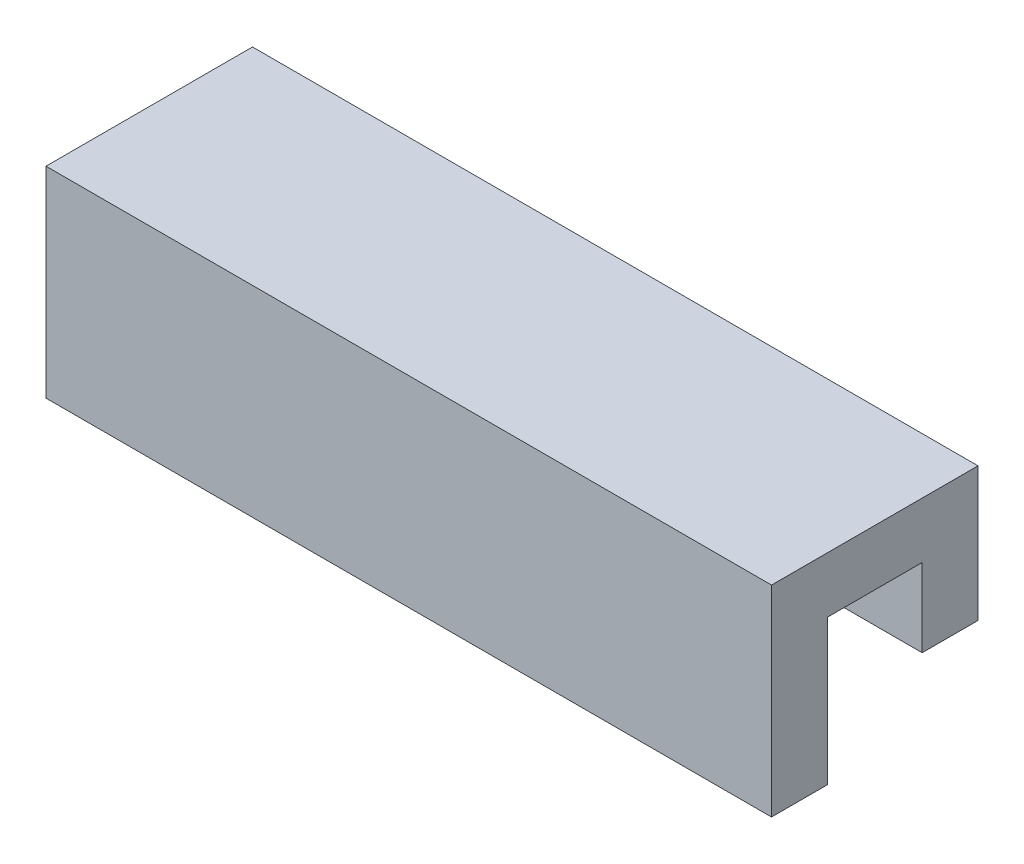
from build123d import *

# Parameters (mm, degrees)
SKETCH_2_W          = 130
SKETCH_2_H          = 36
EXTRUDE_1_DEPTH     = 37
CUT_EXTRUDE_START   = -18
SKETCH_4_W          = 130
SKETCH_4_H          = 17
CUT_EXTRUDE_1_DEPTH = 26
SKETCH_5_W          = 130
SKETCH_5_H          = 12
CUT_EXTRUDE_2_DEPTH = 12


with BuildPart() as part:
    # 스케치2 → 보스-돌출1 (new body)
    with BuildSketch(Plane.XY):
        Rectangle(SKETCH_2_W, SKETCH_2_H)
    extrude(amount=EXTRUDE_1_DEPTH)

    # 스케치4 → 컷-돌출1 (cut)
    with BuildSketch(Plane(origin=(0, 0, 0), x_dir=(1, 0, 0), z_dir=(0, 1, 0)).offset(CUT_EXTRUDE_START)):
        with Locations((0, -18.50644362)):
            Rectangle(SKETCH_4_W, SKETCH_4_H)
    extrude(amount=CUT_EXTRUDE_1_DEPTH, mode=Mode.SUBTRACT)

    # 스케치5 → 컷-돌출2 (cut)
    with BuildSketch(Plane(origin=(0, 0, 0), x_dir=(1, 0, 0), z_dir=(0, 1, 0)).offset(CUT_EXTRUDE_START)):
        with Locations((0, -6)):
            Rectangle(SKETCH_5_W, SKETCH_5_H)
    extrude(amount=CUT_EXTRUDE_2_DEPTH, mode=Mode.SUBTRACT)


solid = part.part
